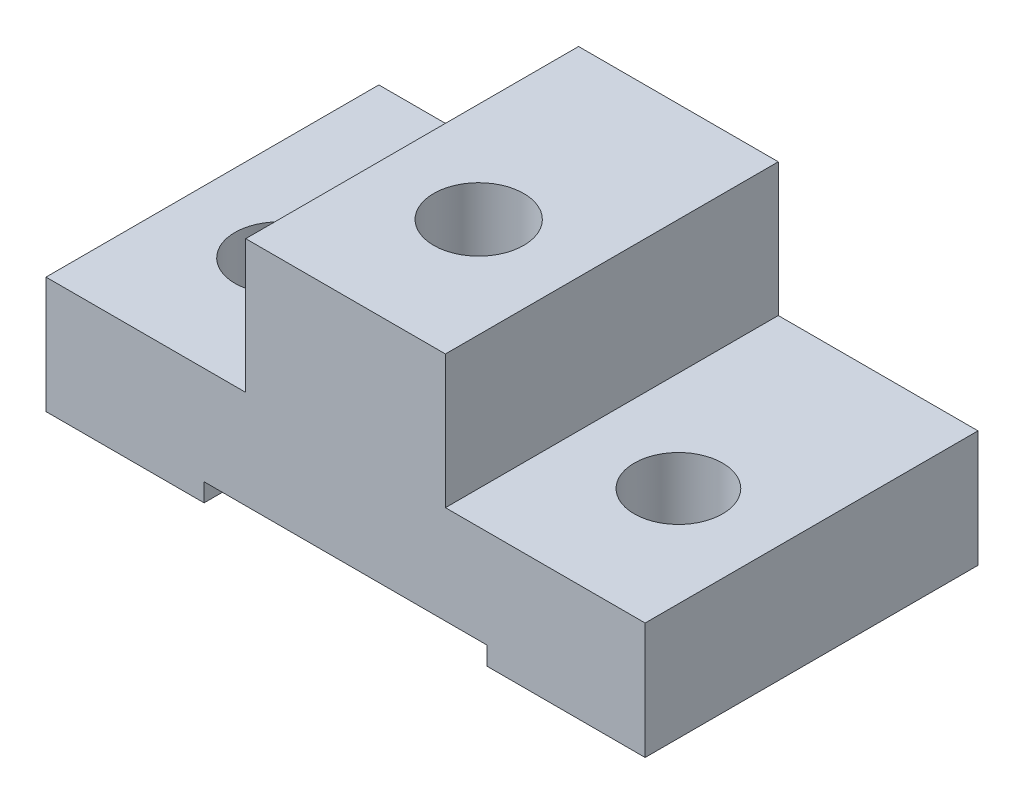
from build123d import *

# Parameters (mm, degrees)
SKETCH_1_W                 = 36
SKETCH_1_H                 = 20
EXTRUDE_1_DEPTH            = 15
SKETCH_2_R                 = 2.65
CUT_EXTRUDE_1_DEPTH        = 26.475478406
SKETCH_3_W                 = 12
SKETCH_3_H                 = 8
CUT_EXTRUDE_2_DEPTH        = 31.805843601
SKETCH_5_W                 = 17
SKETCH_5_H                 = 0.5
CUT_EXTRUDE_3_DEPTH        = 31.805843601
SKETCH_6_W                 = 17
SKETCH_6_H                 = 2
CUT_EXTRUDE_4_DEPTH        = 0.6
SKETCH_7_R                 = 4.9
CUT_EXTRUDE_5_DEPTH        = 0.8
SKETCH_8_R                 = 4
CUT_EXTRUDE_6_DEPTH        = 5
HOLE_WIZARD_1_4_28_1_D     = 5.4102
HOLE_WIZARD_1_4_28_1_DEPTH = 5
HOLE_WIZARD_1_4_28_1_TIP   = 1.625388061
SKETCH_11_R                = 0.5
CUT_EXTRUDE_7_DEPTH        = 23.35374689
HOLE_WIZARD_1_4_28_3_D     = 5.4102
HOLE_WIZARD_1_4_28_3_DEPTH = 4
HOLE_WIZARD_1_4_28_3_TIP   = 1.625388061
SKETCH_16_R                = 0.5
CUT_EXTRUDE_8_DEPTH        = 10


with BuildPart() as part:
    # 草图1 → 凸台-拉伸1 (new body)
    with BuildSketch(Plane(origin=(0, 0, 0), x_dir=(1, 0, 0), z_dir=(0, 1, 0))):
        Rectangle(SKETCH_1_W, SKETCH_1_H)
    extrude(amount=EXTRUDE_1_DEPTH)

    # 草图2 → 切除-拉伸1 (cut, through all)
    with BuildSketch(Plane(origin=(0, 15, 0), x_dir=(1, 0, 0), z_dir=(0, 1, 0))):
        with Locations(Location((-12, -2, 0), (0, 0, 270))):
            Circle(SKETCH_2_R)
        with Locations(Location((12, -2, 0), (0, 0, 270))):
            Circle(SKETCH_2_R)
    extrude(amount=-CUT_EXTRUDE_1_DEPTH, mode=Mode.SUBTRACT)

    # 草图3 → 切除-拉伸2 (cut, through all)
    with BuildSketch(Plane.XY.offset(10)):
        with Locations((-12, 11)):
            Rectangle(SKETCH_3_W, SKETCH_3_H)
        with Locations((12, 11)):
            Rectangle(SKETCH_3_W, SKETCH_3_H)
    extrude(amount=-CUT_EXTRUDE_2_DEPTH, mode=Mode.SUBTRACT)

    # 草图5 → 切除-拉伸3 (cut, through all)
    with BuildSketch(Plane.XY.offset(10)):
        with Locations((0, 0.25)):
            Rectangle(SKETCH_5_W, SKETCH_5_H)
    extrude(amount=-CUT_EXTRUDE_3_DEPTH, mode=Mode.SUBTRACT)

    # 草图6 → 切除-拉伸4 (cut)
    with BuildSketch(Plane.XZ.offset(-0.5)):
        with Locations((0, 9)):
            Rectangle(SKETCH_6_W, SKETCH_6_H)
    extrude(amount=-CUT_EXTRUDE_4_DEPTH, mode=Mode.SUBTRACT)

    # 草图7 → 切除-拉伸5 (cut)
    with BuildSketch(Plane.XZ.offset(-0.5)):
        with Locations(Location((0, 2, 0), (0, 0, 270))):
            Circle(SKETCH_7_R)
    extrude(amount=-CUT_EXTRUDE_5_DEPTH, mode=Mode.SUBTRACT)

    # 草图8 → 切除-拉伸6 (cut)
    with BuildSketch(Plane.XZ.offset(-1.3)):
        with Locations(Location((0, 2, 0), (0, 0, 270))):
            Circle(SKETCH_8_R)
    extrude(amount=-CUT_EXTRUDE_6_DEPTH, mode=Mode.SUBTRACT)

    # 1/4-28 螺纹孔1
    with Locations(Plane(origin=(0, 15, 2), x_dir=(0, 0, 1), z_dir=(0, 1, 0))):
        with Locations((0, 0)):
            Hole(HOLE_WIZARD_1_4_28_1_D / 2, depth=HOLE_WIZARD_1_4_28_1_DEPTH)
            with Locations((0, 0, -(HOLE_WIZARD_1_4_28_1_DEPTH + HOLE_WIZARD_1_4_28_1_TIP / 2))):  # 118° drill point
                Cone(0, HOLE_WIZARD_1_4_28_1_D / 2, HOLE_WIZARD_1_4_28_1_TIP, mode=Mode.SUBTRACT)

    # 草图11 → 切除-拉伸7 (cut, through all)
    with BuildSketch(Plane.XZ.offset(-6.3)):
        with Locations(Location((0, 2, 0), (0, 0, 270))):
            Circle(SKETCH_11_R)
    extrude(amount=-CUT_EXTRUDE_7_DEPTH, mode=Mode.SUBTRACT)

    # 1/4-28 螺纹孔3
    with Locations(Plane(origin=(0, 4.7, -10), x_dir=(-1, 0, 0), z_dir=(0, 0, -1))):
        with Locations((0, 0)):
            Hole(HOLE_WIZARD_1_4_28_3_D / 2, depth=HOLE_WIZARD_1_4_28_3_DEPTH)
            with Locations((0, 0, -(HOLE_WIZARD_1_4_28_3_DEPTH + HOLE_WIZARD_1_4_28_3_TIP / 2))):  # 118° drill point
                Cone(0, HOLE_WIZARD_1_4_28_3_D / 2, HOLE_WIZARD_1_4_28_3_TIP, mode=Mode.SUBTRACT)

    # 草图16 → 切除-拉伸8 (cut)
    with BuildSketch(Plane(origin=(0, 0, -10), x_dir=(-1, 0, 0), z_dir=(0, 0, -1))):
        with Locations((0, 4.7)):
            Circle(SKETCH_16_R)
    extrude(amount=-CUT_EXTRUDE_8_DEPTH, mode=Mode.SUBTRACT)


solid = part.part
